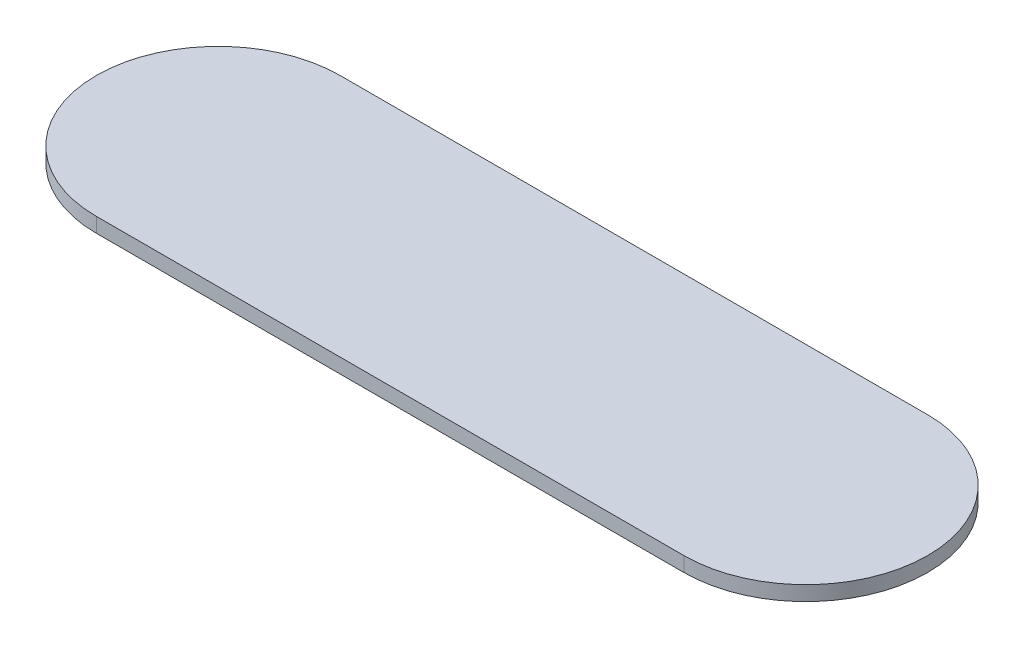
from build123d import *

# Parameters (mm, degrees)
BOSS_EXTRUDE1_DEPTH = 2.5
SKETCH2_R           = 6.25
CUT_EXTRUDE1_DEPTH  = 1


with BuildPart() as part:
    # Sketch1 → Boss-Extrude1 (new body)
    with BuildSketch(Plane(origin=(0, 0, 0), x_dir=(1, 0, 0), z_dir=(0, 1, 0))):
        with BuildLine():
            Line((0, 20.75), (100, 20.75))
            ThreePointArc((100, 20.75), (120.75, 0), (100, -20.75))
            Line((100, -20.75), (0, -20.75))
            ThreePointArc((0, -20.75), (-20.75, 0), (0, 20.75))
        make_face()
    extrude(amount=BOSS_EXTRUDE1_DEPTH)

    # Sketch2 → Cut-Extrude1 (cut)
    with BuildSketch(Plane.XZ):
        with Locations(Location((35, 0, 0), (0, 0, 270))):
            Circle(SKETCH2_R)
        with Locations(Location((65, 0, 0), (0, 0, 270))):
            Circle(SKETCH2_R)
    extrude(amount=-CUT_EXTRUDE1_DEPTH, mode=Mode.SUBTRACT)


solid = part.part
